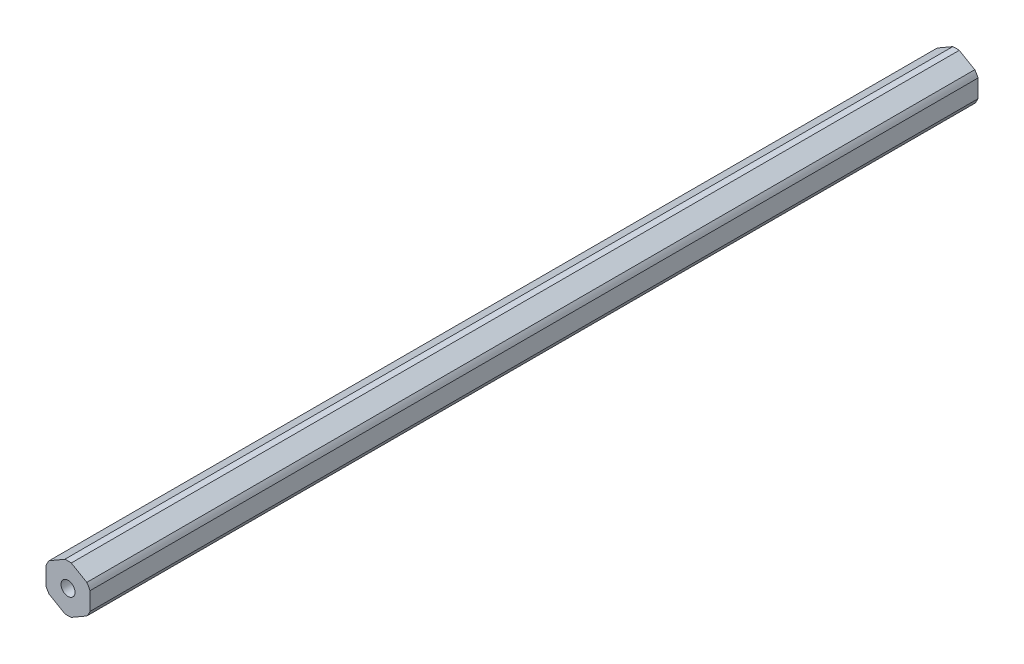
from build123d import *

# Parameters (mm, degrees)
BOSS_EXTRUDE1_DEPTH = 128.0795
SKETCH2_R           = 2.0193
CUT_EXTRUDE1_DEPTH  = 257.329451966


with BuildPart() as part:
    # Sketch1 → Boss-Extrude1 (new, symmetric)
    with BuildSketch(Plane.XY):
        with BuildLine():
            ThreePointArc((0.93173274, 6.79441227), (0, 6.858), (-0.93173274, 6.79441227))
            Line((-0.93173274, 6.79441227), (-5.41826726, 4.204110358))
            ThreePointArc((-5.41826726, 4.204110358), (-5.939202219, 3.429), (-6.35, 2.590301913))
            Line((-6.35, 2.590301913), (-6.35, -2.590301913))
            ThreePointArc((-6.35, -2.590301913), (-5.939202219, -3.429), (-5.41826726, -4.204110358))
            Line((-5.41826726, -4.204110358), (-0.93173274, -6.79441227))
            ThreePointArc((-0.93173274, -6.79441227), (0, -6.858), (0.93173274, -6.79441227))
            Line((0.93173274, -6.79441227), (5.41826726, -4.204110358))
            ThreePointArc((5.41826726, -4.204110358), (5.939202219, -3.429), (6.35, -2.590301913))
            Line((6.35, -2.590301913), (6.35, 2.590301913))
            ThreePointArc((6.35, 2.590301913), (5.939202219, 3.429), (5.41826726, 4.204110358))
            Line((5.41826726, 4.204110358), (0.93173274, 6.79441227))
        make_face()
    extrude(amount=BOSS_EXTRUDE1_DEPTH, both=True)

    # Sketch2 → Cut-Extrude1 (cut, through all)
    with BuildSketch(Plane.XY.offset(128.0795)):
        Circle(SKETCH2_R)
    extrude(amount=-CUT_EXTRUDE1_DEPTH, mode=Mode.SUBTRACT)


solid = part.part
